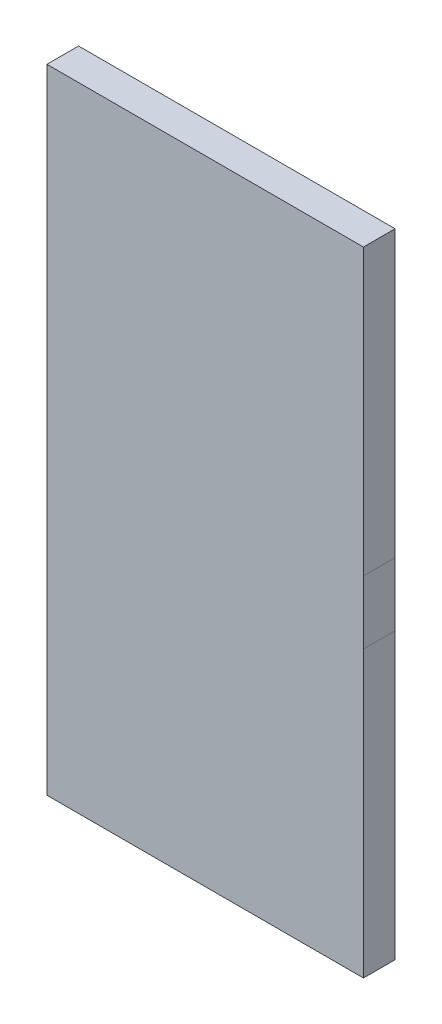
from build123d import *

# Parameters (mm, degrees)
SKETCH1_W           = 1000
SKETCH1_H           = 2000
BOSS_EXTRUDE1_DEPTH = 100


with BuildPart() as part:
    # Sketch1 → Boss-Extrude1 (new body)
    with BuildSketch(Plane.XY):
        with Locations((500, 1000)):
            Rectangle(SKETCH1_W, SKETCH1_H)
    extrude(amount=BOSS_EXTRUDE1_DEPTH)


solid = part.part
